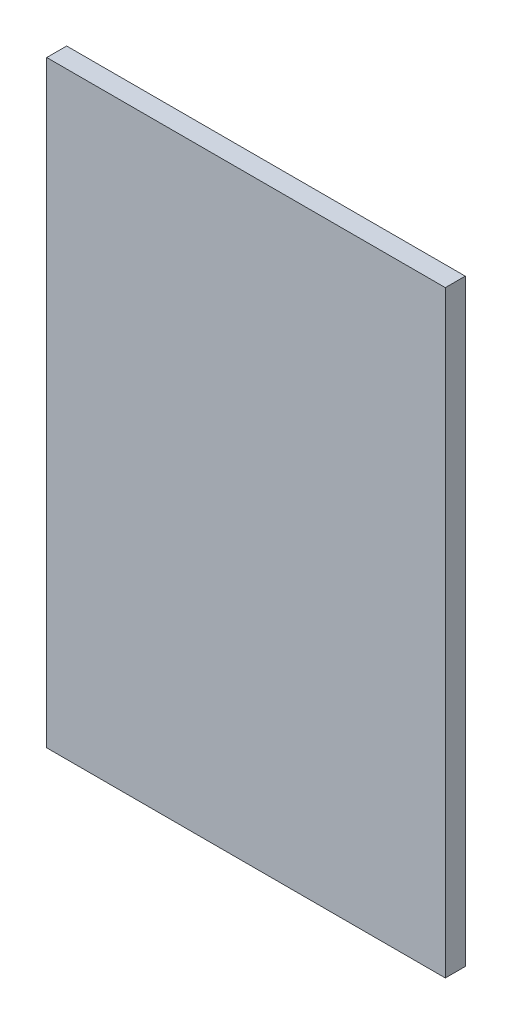
from build123d import *

# Parameters (mm, degrees)
SKETCH1_W      = 200
SKETCH1_H      = 300
EXTRUDE1_DEPTH = 10


with BuildPart() as part:
    # Sketch1 → Extrude1 (new body)
    with BuildSketch(Plane.XY):
        Rectangle(SKETCH1_W, SKETCH1_H)
    extrude(amount=EXTRUDE1_DEPTH)


solid = part.part
